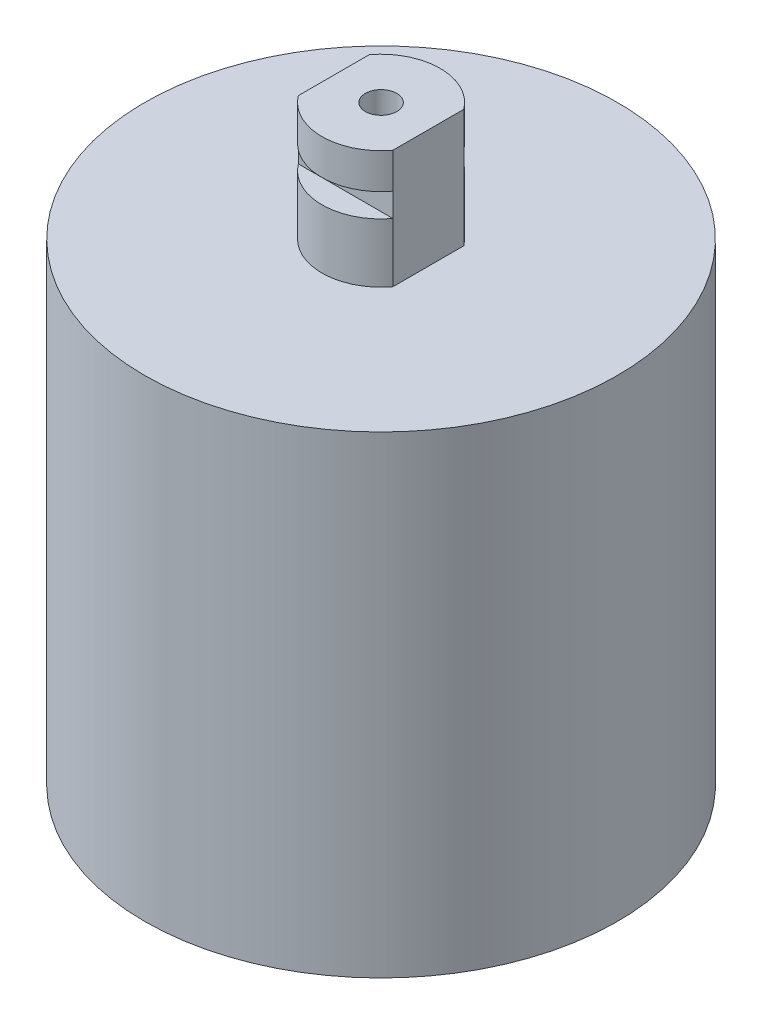
from build123d import *

# Parameters (mm, degrees)
SKETCH1_R           = 60
BOSS_EXTRUDE1_DEPTH = 120
BOSS_EXTRUDE2_DEPTH = 30
CUT_EXTRUDE1_REACH  = 154.263
SKETCH3_W           = 6
SKETCH3_H           = 6
SKETCH4_R           = 4
CUT_EXTRUDE2_DEPTH  = 30


with BuildPart() as part:
    # Sketch1 → Boss-Extrude1 (new body)
    with BuildSketch(Plane(origin=(0, 0, 0), x_dir=(1, 0, 0), z_dir=(0, 1, 0))):
        with Locations(Location((0, 0, 0), (0, 0, 270))):
            Circle(SKETCH1_R)
    extrude(amount=-BOSS_EXTRUDE1_DEPTH)

    # Sketch2 → Boss-Extrude2 (add)
    with BuildSketch(Plane(origin=(0, 0, 0), x_dir=(1, 0, 0), z_dir=(0, 1, 0))):
        with BuildLine():
            Line((-12, 9), (-12, -9))
            ThreePointArc((-12, -9), (0, -15), (12, -9))
            Line((12, -9), (12, 9))
            ThreePointArc((12, 9), (0, 15), (-12, 9))
        make_face()
    extrude(amount=BOSS_EXTRUDE2_DEPTH)

    # Sketch3 → Cut-Extrude1 (cut, up to next)
    with BuildSketch(Plane(origin=(12, 0, 0), x_dir=(0, 0, -1), z_dir=(1, 0, 0)), mode=Mode.PRIVATE) as cut_extrude1_sk1:
        with Locations((-12, 18)):
            Rectangle(SKETCH3_W, SKETCH3_H)
    cut_extrude1_tool1 = extrude(cut_extrude1_sk1.sketch, amount=-CUT_EXTRUDE1_REACH, mode=Mode.PRIVATE) & part.part
    cut_extrude1 = cut_extrude1_tool1.solids().sort_by_distance((12, 18, 12))[0]
    add(cut_extrude1, mode=Mode.SUBTRACT)

    # Mirror1: Cut-Extrude1 across plane
    add(cut_extrude1.mirror(Plane.XY), mode=Mode.SUBTRACT)

    # Sketch4 → Cut-Extrude2 (cut)
    with BuildSketch(Plane(origin=(0, 30, 0), x_dir=(1, 0, 0), z_dir=(0, 1, 0))):
        with Locations(Location((0, 0, 0), (0, 0, 270))):
            Circle(SKETCH4_R)
    extrude(amount=-CUT_EXTRUDE2_DEPTH, mode=Mode.SUBTRACT)


solid = part.part
